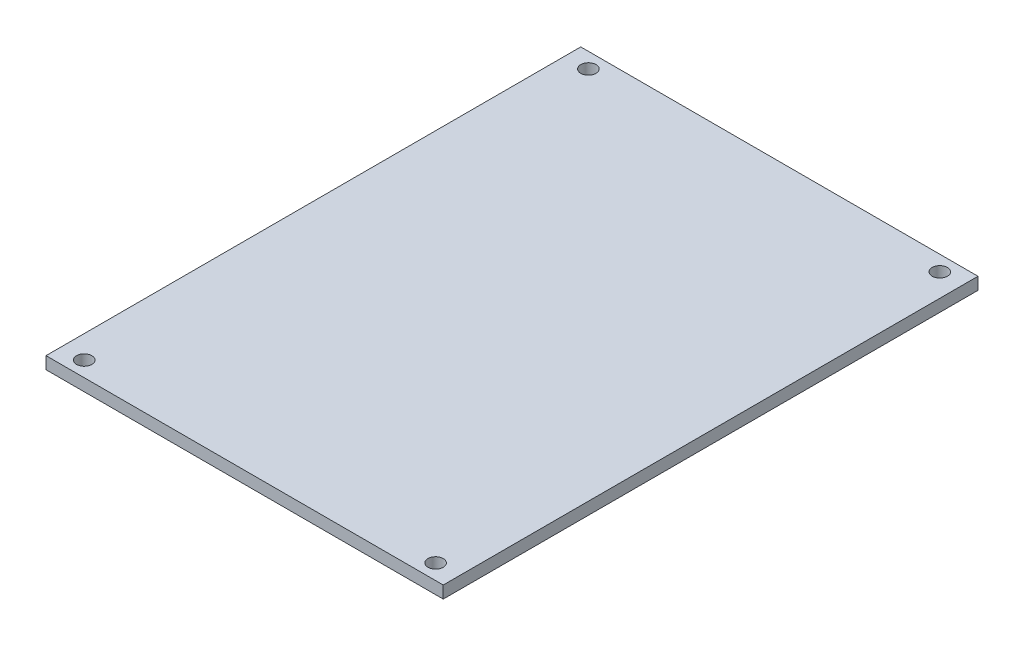
from build123d import *

# Parameters (mm, degrees)
SKETCH_1_W      = 52
SKETCH_1_H      = 70
SKETCH_1_R      = 1
EXTRUDE_1_DEPTH = 1.6


with BuildPart() as part:
    # 草图1 → 凸台-拉伸1 (new body)
    with BuildSketch(Plane(origin=(0, 0, 0), x_dir=(1, 0, 0), z_dir=(0, 1, 0))):
        with Locations((26, 35)):
            Rectangle(SKETCH_1_W, SKETCH_1_H)
        with Locations(Location((3, 2, 0), (0, 0, 270))):
            Circle(SKETCH_1_R, mode=Mode.SUBTRACT)
        with Locations(Location((49, 2, 0), (0, 0, 270))):
            Circle(SKETCH_1_R, mode=Mode.SUBTRACT)
        with Locations(Location((49, 68, 0), (0, 0, 270))):
            Circle(SKETCH_1_R, mode=Mode.SUBTRACT)
        with Locations(Location((3, 68, 0), (0, 0, 270))):
            Circle(SKETCH_1_R, mode=Mode.SUBTRACT)
    extrude(amount=EXTRUDE_1_DEPTH)


solid = part.part
